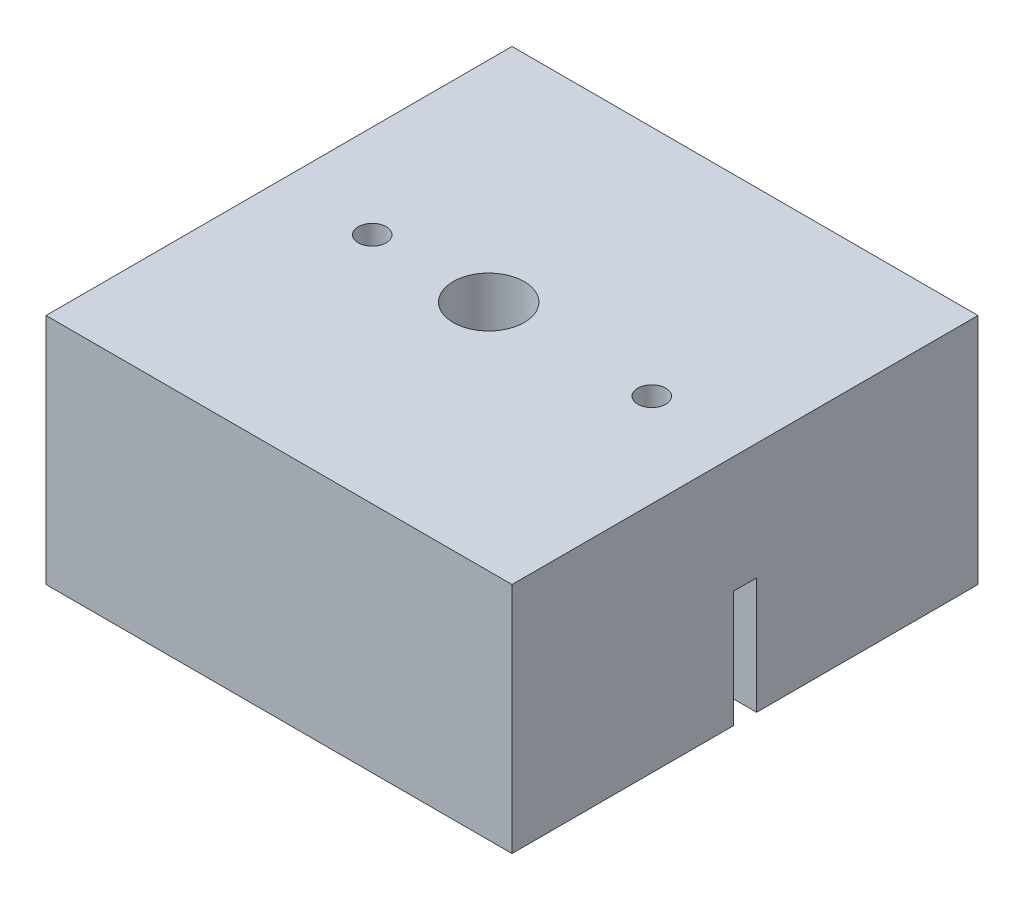
from build123d import *

# Parameters (mm, degrees)
BASEWITH_ALIGNMENT_W = 10
BASEWITH_ALIGNMENT_H = 10
BOSS_EXTRUDE1_DEPTH  = 5
SKETCH1_R            = 0.762
SKETCH1_R_2          = 0.3
CUT_EXTRUDE6_DEPTH   = 9.660254038
CUT_EXTRUDE7_DEPTH   = 2.5
SKETCH2_W            = 10
SKETCH2_H            = 0.5
CUT_EXTRUDE8_DEPTH   = 2.5


with BuildPart() as part:
    # BaseWith Alignment → Boss-Extrude1 (new body)
    with BuildSketch(Plane(origin=(0, 0, 0), x_dir=(1, 0, 0), z_dir=(0, 1, 0))):
        Rectangle(BASEWITH_ALIGNMENT_W, BASEWITH_ALIGNMENT_H)
    extrude(amount=BOSS_EXTRUDE1_DEPTH)

    # Sketch1 → Cut-Extrude6 (cut, through all)
    with BuildSketch(Plane(origin=(0, 0, 0), x_dir=(-1, 0, 0), z_dir=(0, -1, 0))):
        with Locations(Location((0.5, 0, 0), (0, 0, 90))):
            Circle(SKETCH1_R)
        with Locations(Location((3, 0, 0), (0, 0, 90))):
            Circle(SKETCH1_R_2)
        with Locations(Location((-3, 0, 0), (0, 0, 90))):
            Circle(SKETCH1_R_2)
    extrude(amount=-CUT_EXTRUDE6_DEPTH, mode=Mode.SUBTRACT)

    # Sketch1<3> → Cut-Extrude7 (cut)
    with BuildSketch(Plane(origin=(0, 0, 0), x_dir=(-1, 0, 0), z_dir=(0, -1, 0))):
        with BuildLine():
            Line((2.017857143, -1.961432458), (-3.110714286, -1.296526148))
            ThreePointArc((-3.110714286, -1.296526148), (-4.25, 0), (-3.110714286, 1.296526148))
            Line((-3.110714286, 1.296526148), (2.017857143, 1.961432458))
            ThreePointArc((2.017857143, 1.961432458), (4.25, 0), (2.017857143, -1.961432458))
        make_face()
    extrude(amount=-CUT_EXTRUDE7_DEPTH, mode=Mode.SUBTRACT)

    # Sketch2 → Cut-Extrude8 (cut)
    with BuildSketch(Plane.XZ):
        Rectangle(SKETCH2_W, SKETCH2_H)
    extrude(amount=-CUT_EXTRUDE8_DEPTH, mode=Mode.SUBTRACT)


solid = part.part
